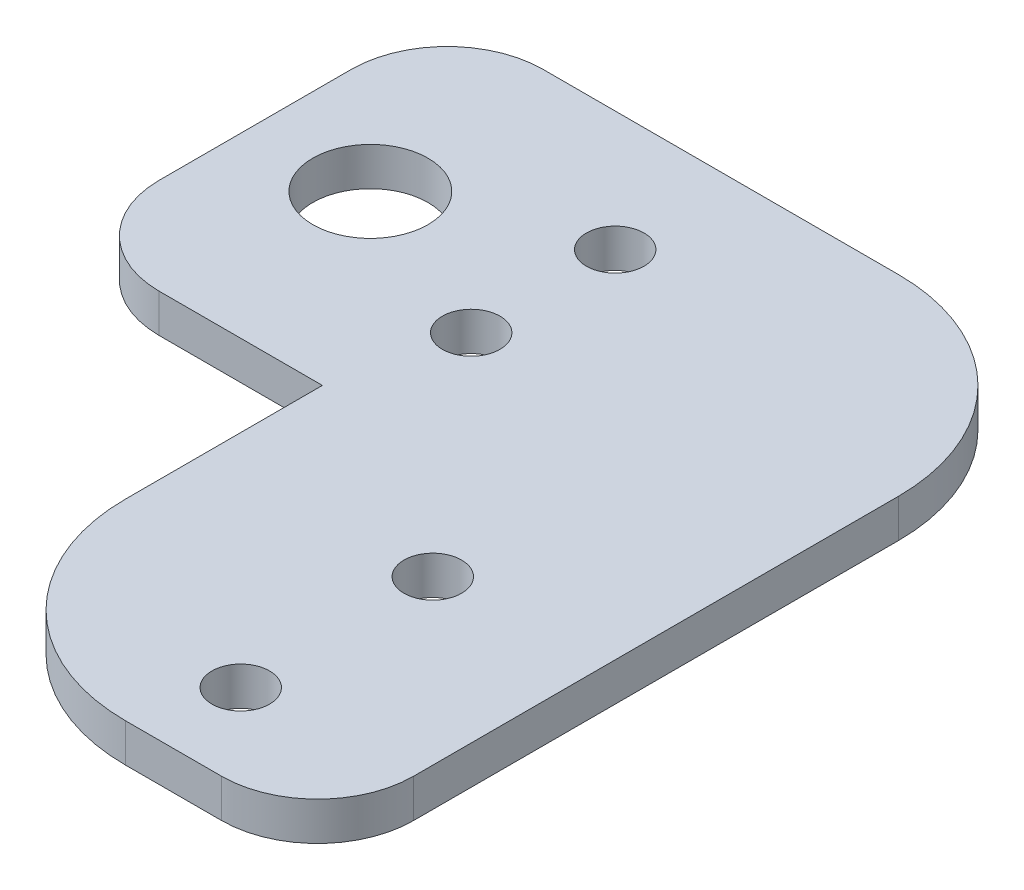
from build123d import *

# Parameters (mm, degrees)
SKETCH1_W           = 25
SKETCH1_H           = 20
BOSS_EXTRUDE1_DEPTH = 2
CUT_EXTRUDE1_REACH  = 18.132
SKETCH2_R           = 1.5
CUT_EXTRUDE2_REACH  = 18.132
SKETCH3_R           = 3
SKETCH4_W           = 20
SKETCH4_H           = 25
BOSS_EXTRUDE2_DEPTH = 2
BOSS_EXTRUDE3_DEPTH = 2
SKETCH6_R           = 1.5
CUT_EXTRUDE3_DEPTH  = 2
SKETCH7_W           = 8.5
SKETCH7_H           = 15.25
BOSS_EXTRUDE5_DEPTH = 2
FILLET1_R           = 10
FILLET2_R           = 5


with BuildPart() as part:
    # Sketch1 → Boss-Extrude1 (new body)
    with BuildSketch(Plane(origin=(0, 0, 0), x_dir=(1, 0, 0), z_dir=(0, 1, 0))):
        Rectangle(SKETCH1_W, SKETCH1_H)
    extrude(amount=BOSS_EXTRUDE1_DEPTH)

    # Sketch2 → Cut-Extrude1 (cut, up to next)
    with BuildSketch(Plane(origin=(0, 2, 0), x_dir=(1, 0, 0), z_dir=(0, 1, 0)), mode=Mode.PRIVATE) as cut_extrude1_sk1:
        with Locations(Location((-6.5, 0, 0), (0, 0, 270))):
            Circle(SKETCH2_R)
    cut_extrude1_tool1 = extrude(cut_extrude1_sk1.sketch, amount=-CUT_EXTRUDE1_REACH, mode=Mode.PRIVATE) & part.part
    # Sketch2 → Cut-Extrude1 (cut, up to next)
    with BuildSketch(Plane(origin=(0, 2, 0), x_dir=(1, 0, 0), z_dir=(0, 1, 0)), mode=Mode.PRIVATE) as cut_extrude1_sk2:
        with Locations(Location((2.5, 3.75, 0), (0, 0, 270))):
            Circle(SKETCH2_R)
    cut_extrude1_tool2 = extrude(cut_extrude1_sk2.sketch, amount=-CUT_EXTRUDE1_REACH, mode=Mode.PRIVATE) & part.part
    # Sketch2 → Cut-Extrude1 (cut, up to next)
    with BuildSketch(Plane(origin=(0, 2, 0), x_dir=(1, 0, 0), z_dir=(0, 1, 0)), mode=Mode.PRIVATE) as cut_extrude1_sk3:
        with Locations(Location((2.5, -3.75, 0), (0, 0, 270))):
            Circle(SKETCH2_R)
    cut_extrude1_tool3 = extrude(cut_extrude1_sk3.sketch, amount=-CUT_EXTRUDE1_REACH, mode=Mode.PRIVATE) & part.part
    add(cut_extrude1_tool1.solids().sort_by_distance((-6.5, 2, 0))[0], mode=Mode.SUBTRACT)
    add(cut_extrude1_tool2.solids().sort_by_distance((2.5, 2, -3.75))[0], mode=Mode.SUBTRACT)
    add(cut_extrude1_tool3.solids().sort_by_distance((2.5, 2, 3.75))[0], mode=Mode.SUBTRACT)

    # Sketch3 → Cut-Extrude2 (cut, up to next)
    with BuildSketch(Plane(origin=(0, 0, 0), x_dir=(-1, 0, 0), z_dir=(0, -1, 0)), mode=Mode.PRIVATE) as cut_extrude2_sk1:
        with Locations(Location((6.5, 0, 0), (0, 0, 90))):
            Circle(SKETCH3_R)
    cut_extrude2_tool1 = extrude(cut_extrude2_sk1.sketch, amount=-CUT_EXTRUDE2_REACH, mode=Mode.PRIVATE) & part.part
    add(cut_extrude2_tool1.solids().sort_by_distance((-6.5, 0, 0))[0], mode=Mode.SUBTRACT)

    # Sketch4 → Boss-Extrude2 (add)
    with BuildSketch(Plane(origin=(0, 2, 0), x_dir=(1, 0, 0), z_dir=(0, 1, 0))):
        with Locations((11, -17.75)):
            Rectangle(SKETCH4_W, SKETCH4_H)
    extrude(amount=-BOSS_EXTRUDE2_DEPTH)

    # Sketch5 → Boss-Extrude3 (add)
    with BuildSketch(Plane(origin=(0, 2, 0), x_dir=(1, 0, 0), z_dir=(0, 1, 0))):
        Polygon((12.5, 10), (12.5, -5.25), (21, -5.25), align=None)
    extrude(amount=-BOSS_EXTRUDE3_DEPTH)

    # Sketch6 → Cut-Extrude3 (cut)
    with BuildSketch(Plane(origin=(0, 2, 0), x_dir=(1, 0, 0), z_dir=(0, 1, 0))):
        with Locations(Location((12.5, -15.75, 0), (0, 0, 270))):
            Circle(SKETCH6_R)
        with Locations(Location((12.5, -25.75, 0), (0, 0, 270))):
            Circle(SKETCH6_R)
    extrude(amount=-CUT_EXTRUDE3_DEPTH, mode=Mode.SUBTRACT)

    # Sketch7 → Boss-Extrude5 (add)
    with BuildSketch(Plane(origin=(0, 2, 0), x_dir=(1, 0, 0), z_dir=(0, 1, 0))):
        with Locations((16.75, 2.375)):
            Rectangle(SKETCH7_W, SKETCH7_H)
    extrude(amount=-BOSS_EXTRUDE5_DEPTH)

    # Fillet1
    fillet1_edges = [part.edges().sort_by_distance(p)[0] for p in [
        (1, 1, 30.25),
        (21, 1, -10),
    ]]
    fillet(fillet1_edges, radius=FILLET1_R)

    # Fillet2
    fillet2_edges = [part.edges().sort_by_distance(p)[0] for p in [
        (21, 1, 30.25),
        (-12.5, 1, 10),
        (-12.5, 1, -10),
    ]]
    fillet(fillet2_edges, radius=FILLET2_R)


solid = part.part
